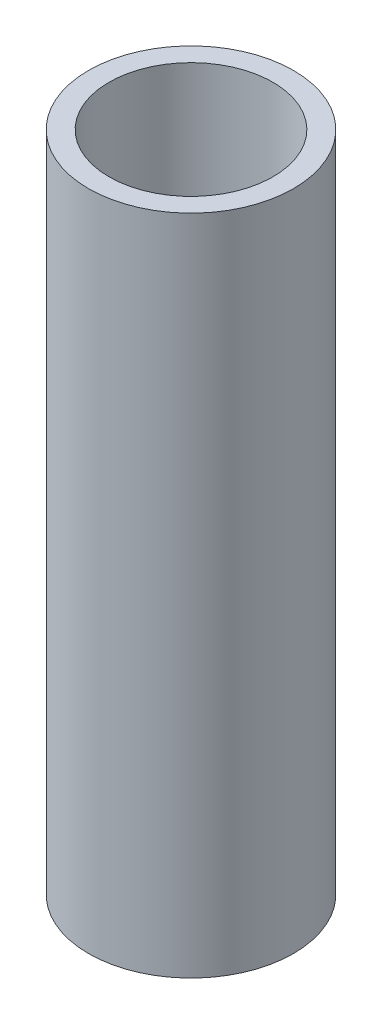
from build123d import *

# Parameters (mm, degrees)
SKETCH1_R                      = 0.375
BOSS_EXTRUDE1_DEPTH            = 2.425
F_0_6_0_6_DIAMETER_HOLE1_D     = 0.6
F_0_6_0_6_DIAMETER_HOLE1_DEPTH = 11.33
F_0_6_0_6_DIAMETER_HOLE1_TIP   = 0.180258186


with BuildPart() as part:
    # Sketch1 → Boss-Extrude1 (new body)
    with BuildSketch(Plane(origin=(0, 0, 0), x_dir=(1, 0, 0), z_dir=(0, 1, 0))):
        with Locations(Location((0, 0, 0), (0, 0, 270))):
            Circle(SKETCH1_R)
    extrude(amount=BOSS_EXTRUDE1_DEPTH)

    # Ø0.6 (0.6) Diameter Hole1
    with Locations(Plane(origin=(0, 2.425, 0), x_dir=(-1, 0, 0), z_dir=(0, 1, 0))):
        with Locations((0, 0)):
            Hole(F_0_6_0_6_DIAMETER_HOLE1_D / 2, depth=F_0_6_0_6_DIAMETER_HOLE1_DEPTH)
            with Locations((0, 0, -(F_0_6_0_6_DIAMETER_HOLE1_DEPTH + F_0_6_0_6_DIAMETER_HOLE1_TIP / 2))):  # 118° drill point
                Cone(0, F_0_6_0_6_DIAMETER_HOLE1_D / 2, F_0_6_0_6_DIAMETER_HOLE1_TIP, mode=Mode.SUBTRACT)


solid = part.part
